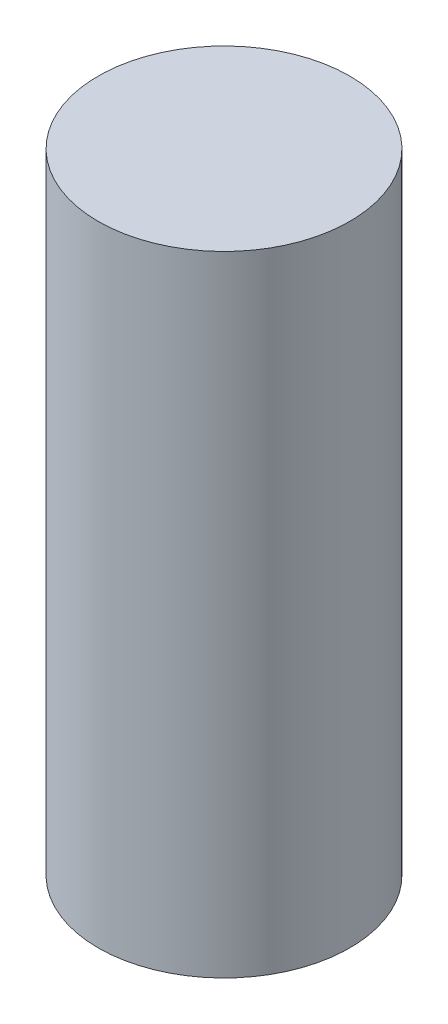
from build123d import *

# Parameters (mm, degrees)
SKETCH1_R           = 20
BOSS_EXTRUDE1_DEPTH = 100
SKETCH2_R           = 10
CUT_EXTRUDE1_DEPTH  = 20


with BuildPart() as part:
    # Sketch1 → Boss-Extrude1 (new body)
    with BuildSketch(Plane(origin=(0, 0, 0), x_dir=(1, 0, 0), z_dir=(0, 1, 0))):
        with Locations(Location((0, 0, 0), (0, 0, 270))):
            Circle(SKETCH1_R)
    extrude(amount=BOSS_EXTRUDE1_DEPTH)

    # Sketch2 → Cut-Extrude1 (cut)
    with BuildSketch(Plane.XZ):
        with Locations(Location((0, 0, 0), (0, 0, 270))):
            Circle(SKETCH2_R)
    extrude(amount=-CUT_EXTRUDE1_DEPTH, mode=Mode.SUBTRACT)


solid = part.part
